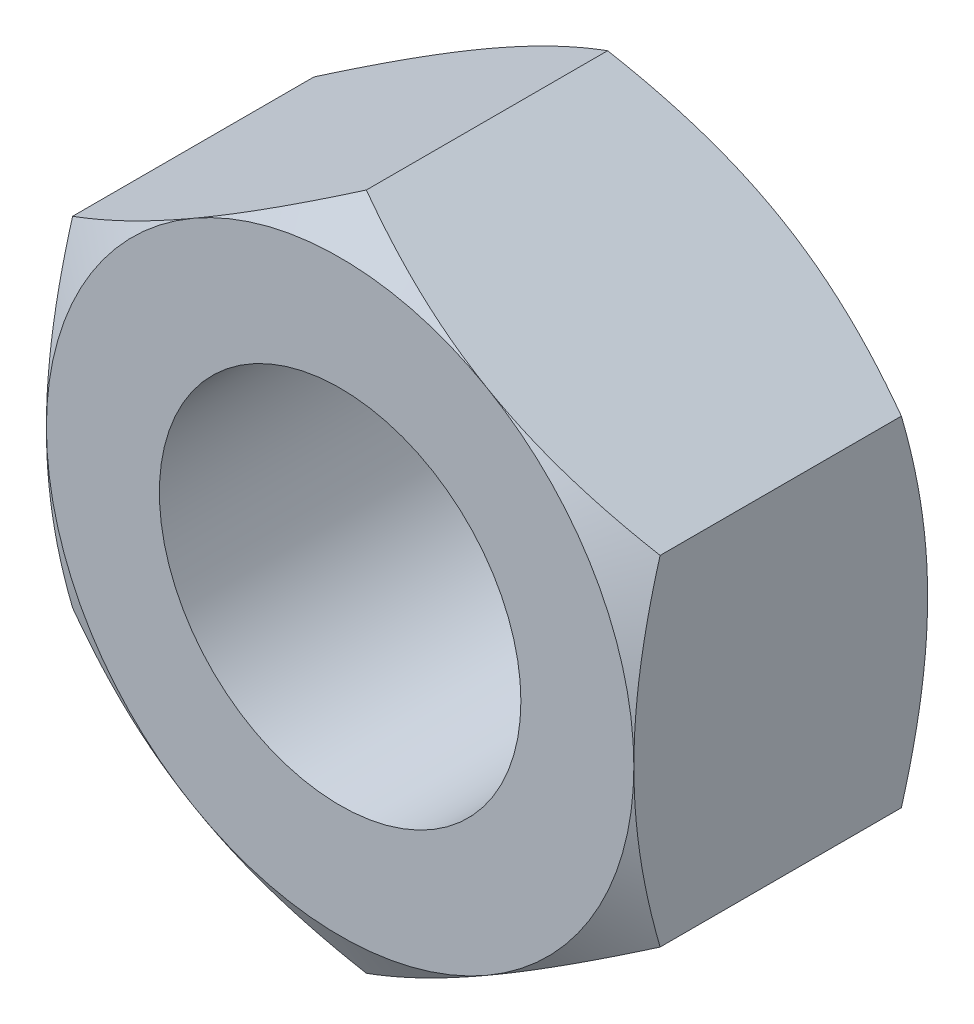
from build123d import *

# Parameters (mm, degrees)
BASE_EXTRUSION_DEPTH    = 6.5
ESQUISSE3_R             = 4
ENL_V_MAT_EXTRU_1_DEPTH = 12.867322079


with BuildPart() as part:
    # Esquisse1 → Base-Extrusion (new body)
    with BuildSketch(Plane.XY):
        Polygon((6.5, -3.75277675), (6.5, 3.75277675), (0, 7.505553499), (-6.5, 3.75277675), (-6.5, -3.75277675), (0, -7.505553499), align=None)
    extrude(amount=-BASE_EXTRUSION_DEPTH)

    # Esquisse2 → Enlèvement de matière-Révolution1 (revolve, cut)
    with BuildSketch(Plane(origin=(0, 0, 0), x_dir=(1, 0, 0), z_dir=(0, 1, 0))):
        Polygon((-6.5, 0), (-13.129165125, 0), (-13.129165125, 6.5), (-6.5, 6.5), (-12.129165125, 3.25), align=None)
    revolve(axis=Axis((0, 0, -6.5), (0, 0, 1)), mode=Mode.SUBTRACT)

    # Esquisse3 → Enlèv. mat.-Extru.1 (cut, through all)
    with BuildSketch(Plane.XY):
        Circle(ESQUISSE3_R)
    extrude(amount=-ENL_V_MAT_EXTRU_1_DEPTH, mode=Mode.SUBTRACT)


solid = part.part
